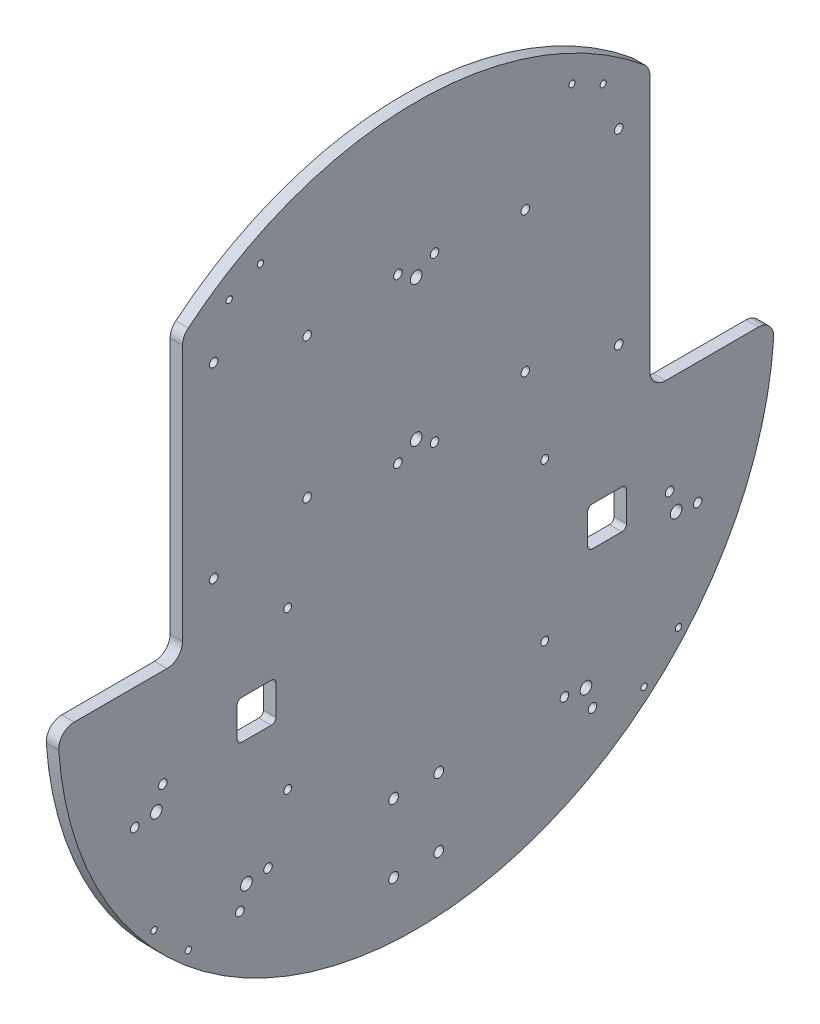
from build123d import *

# Parameters (mm, degrees)
SKETCH_1_R           = 230
EXTRUDE_1_DEPTH      = 8
SKETCH_2_W           = 80
SKETCH_2_H           = 200
CUT_EXTRUDE_1_DEPTH  = 12
SKETCH_3_R           = 2.75
CUT_EXTRUDE_2_DEPTH  = 12
SKETCH_4_R           = 3.15
CUT_EXTRUDE_3_DEPTH  = 12
SKETCH_5_R           = 3.75
SKETCH_5_R_2         = 2.75
CUT_EXTRUDE_4_DEPTH  = 10
FILLET_1_R           = 10
SKETCH_6_W           = 25
SKETCH_6_H           = 25
CUT_EXTRUDE_5_DEPTH  = 10
SKETCH_7_R           = 2.5
CUT_EXTRUDE_6_DEPTH  = 10
SKETCH_8_W           = 25
SKETCH_8_H           = 25
CUT_EXTRUDE_7_DEPTH  = 10
FILLET_3_R           = 3
SKETCH_10_R          = 2
CUT_EXTRUDE_9_DEPTH  = 326.005785815
SKETCH_11_R          = 2
CUT_EXTRUDE_10_DEPTH = 25
FILLET_4_R           = 3


with BuildPart() as part:
    # 草图1 → 凸台-拉伸1 (new body)
    with BuildSketch(Plane(origin=(0, 0, 0), x_dir=(0, 0, -1), z_dir=(1, 0, 0))):
        Circle(SKETCH_1_R)
    extrude(amount=EXTRUDE_1_DEPTH)

    # 草图2 → 切除-拉伸1 (cut)
    with BuildSketch(Plane(origin=(8, 0, 0), x_dir=(0, 0, -1), z_dir=(1, 0, 0))):
        with Locations((-190, 95)):
            Rectangle(SKETCH_2_W, SKETCH_2_H)
        with Locations((190, 95)):
            Rectangle(SKETCH_2_W, SKETCH_2_H)
    extrude(amount=-CUT_EXTRUDE_1_DEPTH, mode=Mode.SUBTRACT)

    # 草图3 → 切除-拉伸2 (cut)
    with BuildSketch(Plane(origin=(8, 0, 0), x_dir=(0, 0, -1), z_dir=(1, 0, 0))):
        with Locations((-130, 150)):
            Circle(SKETCH_3_R)
        with Locations((-130, 30)):
            Circle(SKETCH_3_R)
        with Locations((130, 30)):
            Circle(SKETCH_3_R)
        with Locations((130, 150)):
            Circle(SKETCH_3_R)
        with Locations((-70, 135)):
            Circle(SKETCH_3_R)
        with Locations((-70, 45)):
            Circle(SKETCH_3_R)
        with Locations((70, 135)):
            Circle(SKETCH_3_R)
        with Locations((70, 45)):
            Circle(SKETCH_3_R)
    extrude(amount=-CUT_EXTRUDE_2_DEPTH, mode=Mode.SUBTRACT)

    # 草图4 → 切除-拉伸3 (cut)
    with BuildSketch(Plane(origin=(8, 0, 0), x_dir=(0, 0, -1), z_dir=(1, 0, 0))):
        with Locations((-14.5, -150)):
            Circle(SKETCH_4_R)
        with Locations((14.5, -150)):
            Circle(SKETCH_4_R)
        with Locations((14.5, -194)):
            Circle(SKETCH_4_R)
        with Locations((-14.5, -194)):
            Circle(SKETCH_4_R)
    extrude(amount=-CUT_EXTRUDE_3_DEPTH, mode=Mode.SUBTRACT)

    # 草图5 → 切除-拉伸4 (cut)
    with BuildSketch(Plane(origin=(8, 0, 0), x_dir=(0, 0, -1), z_dir=(1, 0, 0))):
        with Locations((166.813442197, -81.229769803)):
            Circle(SKETCH_5_R)
        with Locations((108.962557326, -150.173769684)):
            Circle(SKETCH_5_R)
        with Locations((-108.962557326, -150.173769684)):
            Circle(SKETCH_5_R)
        with Locations((-166.813442197, -81.229769803)):
            Circle(SKETCH_5_R)
        with Locations((-11.75, 35)):
            Circle(SKETCH_5_R_2)
        with Locations((11.75, 35)):
            Circle(SKETCH_5_R_2)
        with Locations((95.140628046, -148.366348594)):
            Circle(SKETCH_5_R_2)
        with Locations((162.633327063, -67.931682066)):
            Circle(SKETCH_5_R_2)
        with Locations((180.635371477, -83.037190894)):
            Circle(SKETCH_5_R_2)
        with Locations((113.14267246, -163.471857421)):
            Circle(SKETCH_5_R_2)
        with Locations((-180.635371477, -83.037190894)):
            Circle(SKETCH_5_R_2)
        with Locations((-162.633327063, -67.931682066)):
            Circle(SKETCH_5_R_2)
        with Locations((-95.140628046, -148.366348594)):
            Circle(SKETCH_5_R_2)
        with Locations((-113.14267246, -163.471857421)):
            Circle(SKETCH_5_R_2)
        with Locations((11.75, 140)):
            Circle(SKETCH_5_R_2)
        with Locations((-11.75, 140)):
            Circle(SKETCH_5_R_2)
        with Locations((0, 132.5)):
            Circle(SKETCH_5_R)
        with Locations((0, 42.5)):
            Circle(SKETCH_5_R)
    extrude(amount=-CUT_EXTRUDE_4_DEPTH, mode=Mode.SUBTRACT)

    # 圆角1
    fillet_1_edges = [part.edges().sort_by_distance(p)[0] for p in [
        (4, 174.355957742, -150),
        (4, -5, -150),
        (4, -5, -229.945645751),
        (4, 174.355957742, 150),
        (4, -5, 229.945645751),
        (4, -5, 150),
    ]]
    fillet(fillet_1_edges, radius=FILLET_1_R)

    # 草图6 → 切除-拉伸5 (cut)
    with BuildSketch(Plane(origin=(8, 0, 0), x_dir=(0, 0, -1), z_dir=(1, 0, 0))):
        with Locations((-102.5, -57.5)):
            Rectangle(SKETCH_6_W, SKETCH_6_H)
    extrude(amount=-CUT_EXTRUDE_5_DEPTH, mode=Mode.SUBTRACT)

    # 草图7 → 切除-拉伸6 (cut)
    with BuildSketch(Plane(origin=(8, 0, 0), x_dir=(0, 0, -1), z_dir=(1, 0, 0))):
        with Locations((82.5, -10)):
            Circle(SKETCH_7_R)
        with Locations((82.5, -111)):
            Circle(SKETCH_7_R)
        with Locations((-82.5, -10)):
            Circle(SKETCH_7_R)
        with Locations((-82.5, -111)):
            Circle(SKETCH_7_R)
    extrude(amount=-CUT_EXTRUDE_6_DEPTH, mode=Mode.SUBTRACT)

    # 草图8 → 切除-拉伸7 (cut)
    with BuildSketch(Plane(origin=(8, 0, 0), x_dir=(0, 0, -1), z_dir=(1, 0, 0))):
        with Locations((122.5, -62.5)):
            Rectangle(SKETCH_8_W, SKETCH_8_H)
    extrude(amount=-CUT_EXTRUDE_7_DEPTH, mode=Mode.SUBTRACT)

    # 圆角3
    fillet_3_edges = [part.edges().sort_by_distance(p)[0] for p in [
        (4, -75, -110),
        (4, -50, -110),
        (4, -50, -135),
        (4, -75, -135),
    ]]
    fillet(fillet_3_edges, radius=FILLET_3_R)

    # 草图10 → 切除-拉伸9 (cut, through all)
    with BuildSketch(Plane(origin=(8, 0, 0), x_dir=(0, 0, -1), z_dir=(1, 0, 0))):
        with Locations((168.30023639, -146.301163465)):
            Circle(SKETCH_10_R)
        with Locations((146.301163465, -168.30023639)):
            Circle(SKETCH_10_R)
        with Locations(Location((-146.301163465, -168.30023639, 0), (0, 0, 180))):
            Circle(SKETCH_10_R)
        with Locations(Location((-168.30023639, -146.301163465, 0), (0, 0, 180))):
            Circle(SKETCH_10_R)
    extrude(amount=-CUT_EXTRUDE_9_DEPTH, mode=Mode.SUBTRACT)

    # 草图11 → 切除-拉伸10 (cut)
    with BuildSketch(Plane(origin=(8, 0, 0), x_dir=(0, 0, -1), z_dir=(1, 0, 0))):
        with Locations((100, 190)):
            Circle(SKETCH_11_R)
        with Locations((120, 180)):
            Circle(SKETCH_11_R)
        with Locations((-120, 180)):
            Circle(SKETCH_11_R)
        with Locations((-100, 190)):
            Circle(SKETCH_11_R)
    extrude(amount=-CUT_EXTRUDE_10_DEPTH, mode=Mode.SUBTRACT)

    # 圆角4
    fillet_4_edges = [part.edges().sort_by_distance(p)[0] for p in [
        (4, -70, 115),
        (4, -45, 115),
        (4, -45, 90),
        (4, -70, 90),
    ]]
    fillet(fillet_4_edges, radius=FILLET_4_R)


solid = part.part
